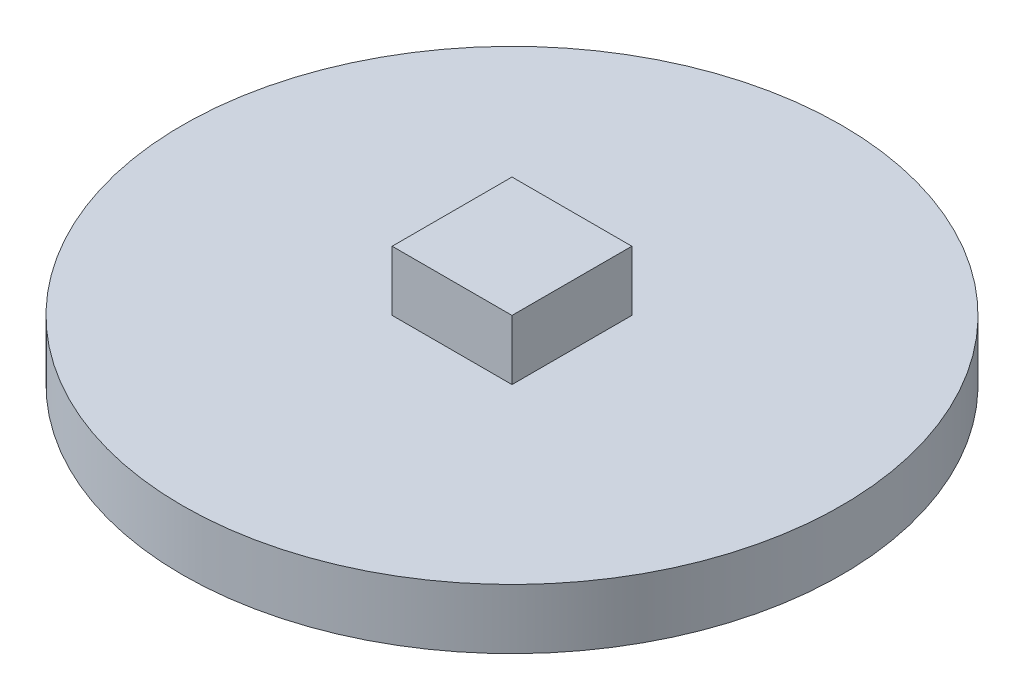
from build123d import *

# Parameters (mm, degrees)
SKETCH1_R           = 11
BOSS_EXTRUDE1_DEPTH = 2
SKETCH2_W           = 4
SKETCH2_H           = 4
BOSS_EXTRUDE2_DEPTH = 2


with BuildPart() as part:
    # Sketch1 → Boss-Extrude1 (new body)
    with BuildSketch(Plane(origin=(0, 0, 0), x_dir=(1, 0, 0), z_dir=(0, 1, 0))):
        with Locations(Location((0, 0, 0), (0, 0, 270))):
            Circle(SKETCH1_R)
    extrude(amount=BOSS_EXTRUDE1_DEPTH)

    # Sketch2 → Boss-Extrude2 (add)
    with BuildSketch(Plane(origin=(0, 2, 0), x_dir=(1, 0, 0), z_dir=(0, 1, 0))):
        Rectangle(SKETCH2_W, SKETCH2_H)
    extrude(amount=BOSS_EXTRUDE2_DEPTH)


solid = part.part
